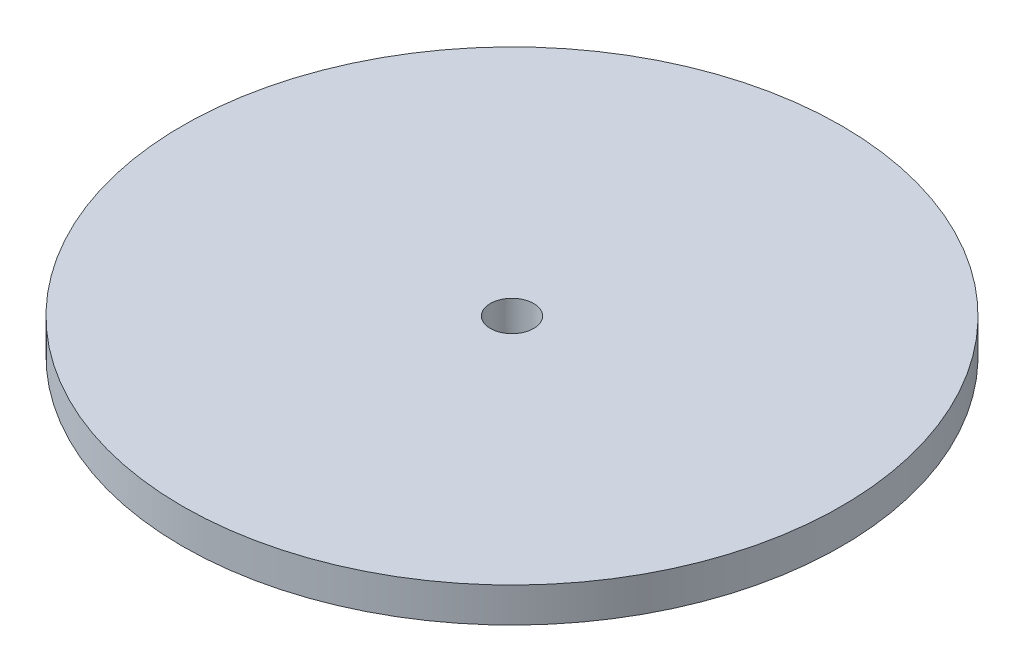
from build123d import *

# Parameters (mm, degrees)
SKETCH1_R           = 38
SKETCH1_R_2         = 2.5
BOSS_EXTRUDE1_DEPTH = 4


with BuildPart() as part:
    # Sketch1 → Boss-Extrude1 (new body)
    with BuildSketch(Plane(origin=(0, 0, 0), x_dir=(1, 0, 0), z_dir=(0, 1, 0))):
        with Locations(Location((0, 0, 0), (0, 0, 270))):
            Circle(SKETCH1_R)
        with Locations(Location((0, 0, 0), (0, 0, 270))):
            Circle(SKETCH1_R_2, mode=Mode.SUBTRACT)
    extrude(amount=BOSS_EXTRUDE1_DEPTH)


solid = part.part
